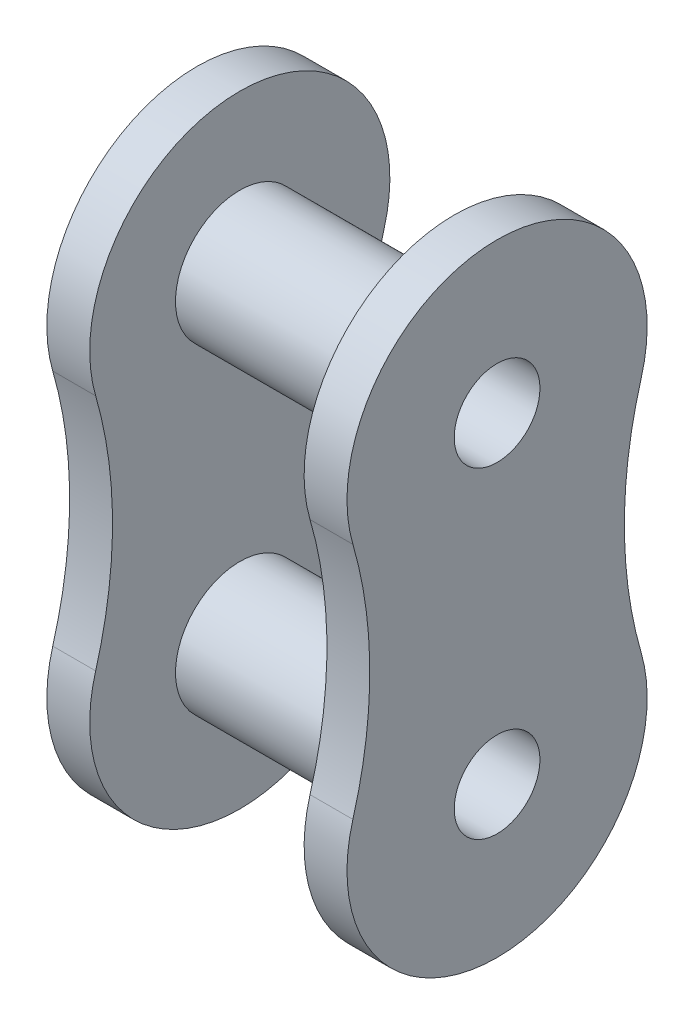
from build123d import *

# Parameters (mm, degrees)
SKETCH2_R           = 1
BOSS_EXTRUDE1_DEPTH = 1
BOSS_EXTRUDE2_START = 2.5
SKETCH2_3_R         = 1.5
SKETCH2_3_R_2       = 1
BOSS_EXTRUDE2_DEPTH = 2.5


with BuildPart() as part:
    # Sketch2 → Boss-Extrude1 (new body)
    with BuildSketch(Plane.YZ):
        with BuildLine():
            ThreePointArc((-2.777777778, 3.362258757), (-7.25, 0), (-2.777777778, -3.362258757))
            ThreePointArc((-2.777777778, -3.362258757), (0, -2.968712349), (2.777777778, -3.362258757))
            ThreePointArc((2.777777778, -3.362258757), (7.25, 0), (2.777777778, 3.362258757))
            ThreePointArc((2.777777778, 3.362258757), (0, 2.968712349), (-2.777777778, 3.362258757))
        make_face()
        with Locations((-3.75, 0)):
            Circle(SKETCH2_R, mode=Mode.SUBTRACT)
        with Locations((3.75, 0)):
            Circle(SKETCH2_R, mode=Mode.SUBTRACT)
    extrude(amount=-BOSS_EXTRUDE1_DEPTH)

    # Sketch2<3> → Boss-Extrude2 (add)
    # profile 1 of 2: a face of its own
    with BuildSketch(Plane.YZ.offset(BOSS_EXTRUDE2_START)):
        with Locations((-3.75, 0)):
            Circle(SKETCH2_3_R)
        with Locations((-3.75, 0)):
            Circle(SKETCH2_3_R_2, mode=Mode.SUBTRACT)
    # profile 2 of 2: a face of its own
    with BuildSketch(Plane.YZ.offset(BOSS_EXTRUDE2_START)):
        with Locations((3.75, 0)):
            Circle(SKETCH2_3_R)
        with Locations((3.75, 0)):
            Circle(SKETCH2_3_R_2, mode=Mode.SUBTRACT)
    extrude(amount=-BOSS_EXTRUDE2_DEPTH)

    # Mirror1: part across plane


with BuildPart() as part_1:
    add(part.part)
    add(part.part.mirror(Plane(origin=(2.5, 0, 0), x_dir=(0, 0, 1), z_dir=(1, 0, 0))))


solid = part_1.part
